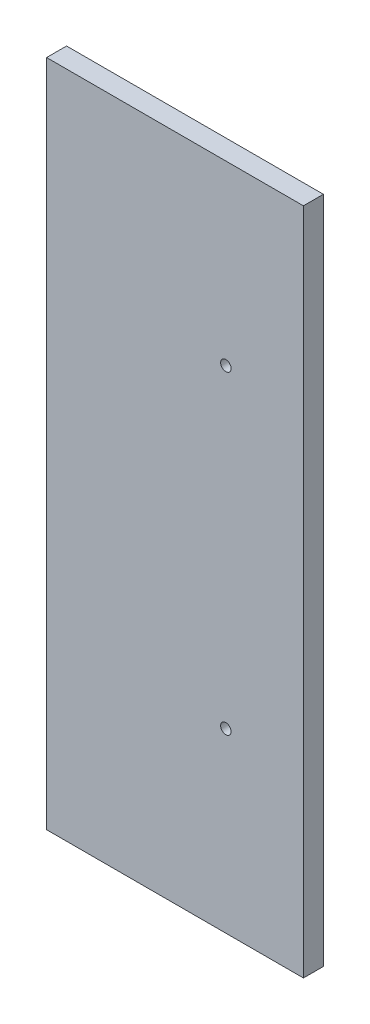
from build123d import *

# Parameters (mm, degrees)
SKETCH1_W                  = 245.05
SKETCH1_H                  = 638.1
BOSS_EXTRUDE1_DEPTH        = 19.05
F_10_0MM_DOWEL_HOLE1_D     = 10
F_10_0MM_DOWEL_HOLE1_DEPTH = 26.995696905
F_10_0MM_DOWEL_HOLE1_TIP   = 3.004303095


with BuildPart() as part:
    # Sketch1 → Boss-Extrude1 (new body)
    with BuildSketch(Plane.XY):
        with Locations((-122.525, -319.05)):
            Rectangle(SKETCH1_W, SKETCH1_H)
    extrude(amount=BOSS_EXTRUDE1_DEPTH)

    # Ø10.0mm Dowel Hole1
    with Locations(Plane(origin=(0, 0, 0), x_dir=(-1, 0, 0), z_dir=(0, 0, -1))):
        with Locations((74, -469.05), (74, -169.05)):
            Hole(F_10_0MM_DOWEL_HOLE1_D / 2, depth=F_10_0MM_DOWEL_HOLE1_DEPTH)
            with Locations((0, 0, -(F_10_0MM_DOWEL_HOLE1_DEPTH + F_10_0MM_DOWEL_HOLE1_TIP / 2))):  # 118° drill point
                Cone(0, F_10_0MM_DOWEL_HOLE1_D / 2, F_10_0MM_DOWEL_HOLE1_TIP, mode=Mode.SUBTRACT)


solid = part.part
